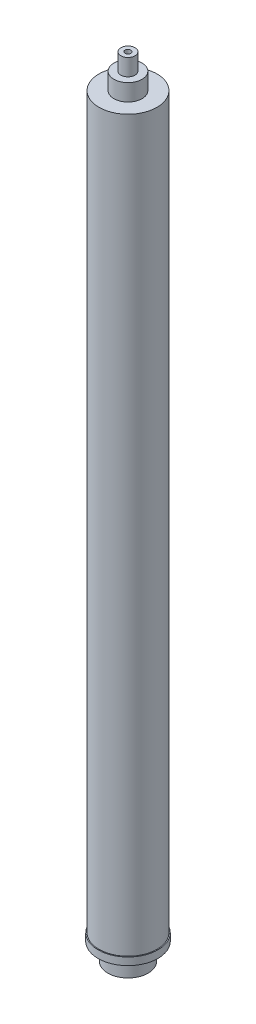
from build123d import *

# Parameters (mm, degrees)
SKETCH2_R          = 4.95
CUT_EXTRUDE1_DEPTH = 25.4
SKETCH5_R          = 27.5
CUT_EXTRUDE3_DEPTH = 1000


with BuildPart() as part:
    # Sketch1 → Revolve1 (revolve)
    with BuildSketch(Plane(origin=(0, 0, 0), x_dir=(0, 0, -1), z_dir=(1, 0, 0))):
        Polygon((0, 0), (-11.938, 0), (-11.938, -28.575), (-23.876, -28.575), (-23.876, -57.15), (-49.2125, -57.15), (-49.2125, -1295.654), (-50.8, -1295.654), (-50.8, -1308.354), (-34.29, -1308.354), (-34.29, -1338.199), (0, -1338.199), align=None)
    revolve(axis=Axis((0, 0, 0), (0, -1, 0)))

    # Sketch2 → Cut-Extrude1 (cut)
    with BuildSketch(Plane(origin=(0, 0, 0), x_dir=(1, 0, 0), z_dir=(0, 1, 0))):
        with Locations(Location((0, 0, 0), (0, 0, 270))):
            Circle(SKETCH2_R)
    extrude(amount=-CUT_EXTRUDE1_DEPTH, mode=Mode.SUBTRACT)

    # Sketch5 → Cut-Extrude3 (cut)
    with BuildSketch(Plane.XZ.offset(1338.199)):
        with Locations(Location((0, 0, 0), (0, 0, 270))):
            Circle(SKETCH5_R)
    extrude(amount=-CUT_EXTRUDE3_DEPTH, mode=Mode.SUBTRACT)


solid = part.part
